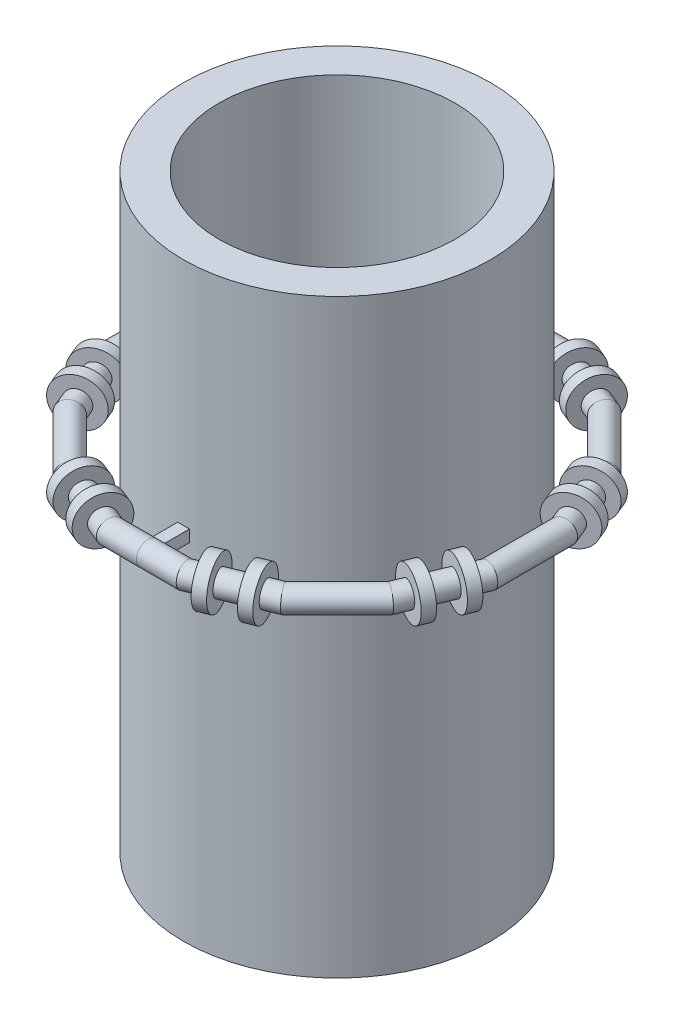
from build123d import *

# Parameters (mm, degrees)
CROQUIS1_R                   = 6.5
CROQUIS1_R_2                 = 5
SALIENTE_EXTRUIR1_DEPTH      = 25
CROQUIS3_R                   = 0.5
SALIENTE_EXTRUIR2_REACH      = 32.125
SALIENTE_EXTRUIR2_END_RADIUS = 0.5
CROQUIS4_W                   = 0.5
CROQUIS4_H                   = 0.5
SALIENTE_EXTRUIR3_REACH      = 32.125
SALIENTE_EXTRUIR3_END_RADIUS = 0.5
CROQUIS6_W                   = 0.5
CROQUIS6_H                   = 0.5
CROQUIS9_R                   = 1
SALIENTE_EXTRUIR4_DEPTH      = 0.5
SIMETR_A2_COPY_1_SKETCH_R    = 1
SIMETR_A2_COPY_1_DEPTH       = 0.5
SIMETR_A3_COPY_1_SKETCH_R    = 1
SIMETR_A3_COPY_1_DEPTH       = 0.5
SIMETR_A3_COPY_2_SKETCH_R    = 1
SIMETR_A3_COPY_2_DEPTH       = 0.5
SIMETR_A3_COPY_3_SKETCH_R    = 1
SIMETR_A3_COPY_3_DEPTH       = 0.5
SIMETR_A4_COPY_1_SKETCH_R    = 1
SIMETR_A4_COPY_1_DEPTH       = 0.5
SIMETR_A4_COPY_2_SKETCH_R    = 1
SIMETR_A4_COPY_2_DEPTH       = 0.5
SIMETR_A4_COPY_3_SKETCH_R    = 1
SIMETR_A4_COPY_3_DEPTH       = 0.5
SIMETR_A4_COPY_4_SKETCH_R    = 1
SIMETR_A4_COPY_4_DEPTH       = 0.5
SIMETR_A4_COPY_5_SKETCH_R    = 1
SIMETR_A4_COPY_5_DEPTH       = 0.5
SIMETR_A4_COPY_6_SKETCH_R    = 1
SIMETR_A4_COPY_6_DEPTH       = 0.5
SIMETR_A4_COPY_7_SKETCH_R    = 1
SIMETR_A4_COPY_7_DEPTH       = 0.5
SIMETR_A4_COPY_8_SKETCH_R    = 1
SIMETR_A4_COPY_8_DEPTH       = 0.5
SIMETR_A5_COPY_1_SKETCH_R    = 1
SIMETR_A5_COPY_1_DEPTH       = 0.5
SIMETR_A5_COPY_2_SKETCH_R    = 1
SIMETR_A5_COPY_2_DEPTH       = 0.5
SIMETR_A5_COPY_3_SKETCH_R    = 1
SIMETR_A5_COPY_3_DEPTH       = 0.5
SIMETR_A5_COPY_4_SKETCH_R    = 1
SIMETR_A5_COPY_4_DEPTH       = 0.5
SIMETR_A5_COPY_5_SKETCH_R    = 1
SIMETR_A5_COPY_5_DEPTH       = 0.5
SIMETR_A5_COPY_6_SKETCH_R    = 1
SIMETR_A5_COPY_6_DEPTH       = 0.5
SIMETR_A5_COPY_7_SKETCH_R    = 1
SIMETR_A5_COPY_7_DEPTH       = 0.5
SIMETR_A5_COPY_8_SKETCH_R    = 1
SIMETR_A5_COPY_8_DEPTH       = 0.5
SIMETR_A5_COPY_9_SKETCH_R    = 1
SIMETR_A5_COPY_9_DEPTH       = 0.5


with BuildPart() as part:
    # Croquis1 → Saliente-Extruir1 (new body)
    with BuildSketch(Plane(origin=(0, 0, 0), x_dir=(1, 0, 0), z_dir=(0, 1, 0))):
        with Locations(Location((0, 0, 0), (0, 0, 270))):
            Circle(CROQUIS1_R)
        with Locations(Location((0, 0, 0), (0, 0, 270))):
            Circle(CROQUIS1_R_2, mode=Mode.SUBTRACT)
    extrude(amount=SALIENTE_EXTRUIR1_DEPTH)



with BuildPart() as body_2:
    # Barrer1: sweep along a path in Croquis2
    with BuildLine(Plane(origin=(0, 15, 0), x_dir=(1, 0, 0), z_dir=(0, 1, 0))) as barrer1_path:
        Line((-4.531635979, -6.78207252), (-1.591298939, -8))
        Line((-1.591298939, -8), (1.591298939, -8))
        Line((1.591298939, -8), (4.531635979, -6.78207252))
        Line((4.531635979, -6.78207252), (6.78207252, -4.531635979))
        Line((6.78207252, -4.531635979), (8, -1.591298939))
        Line((8, -1.591298939), (8, 1.591298939))
        Line((8, 1.591298939), (6.78207252, 4.531635979))
        Line((6.78207252, 4.531635979), (4.531635979, 6.78207252))
        Line((4.531635979, 6.78207252), (1.591298939, 8))
        Line((1.591298939, 8), (-1.591298939, 8))
        Line((-1.591298939, 8), (-4.531635979, 6.78207252))
        Line((-4.531635979, 6.78207252), (-6.78207252, 4.531635979))
        Line((-6.78207252, 4.531635979), (-8, 1.591298939))
        Line((-8, 1.591298939), (-8, -1.591298939))
        Line((-8, -1.591298939), (-6.78207252, -4.531635979))
        Line((-6.78207252, -4.531635979), (-4.531635979, -6.78207252))
    # Croquis3 → Barrer1 (sweep)
    with BuildSketch(Plane(origin=(0, 0, 0), x_dir=(0, 0, -1), z_dir=(1, 0, 0))):
        with Locations((-8, 15)):
            Circle(CROQUIS3_R)
    sweep(path=barrer1_path.line, transition=Transition.RIGHT)


with BuildPart() as part_1:
    add(part.part)

    add(body_2.part)  # Saliente-Extruir2 merges body 2
    # Saliente-Extruir2: up to this cylinder (the profile starts outside it)
    saliente_extruir2_end = Plane(origin=(0, 15, 8), z_dir=(-1, 0, 0)) * Cylinder(SALIENTE_EXTRUIR2_END_RADIUS, 66.25, mode=Mode.PRIVATE)
    # Croquis4 → Saliente-Extruir2 (add, up to the surface)
    with BuildSketch(Plane.XY.offset(6), mode=Mode.PRIVATE) as saliente_extruir2_sk1:
        with Locations((0, 15)):
            Rectangle(CROQUIS4_W, CROQUIS4_H)
    saliente_extruir2_tool1 = extrude(saliente_extruir2_sk1.sketch, amount=SALIENTE_EXTRUIR2_REACH, mode=Mode.PRIVATE) - saliente_extruir2_end
    add(saliente_extruir2_tool1.solids().sort_by_distance((0, 15, 6))[0])

    # Saliente-Extruir3: up to this cylinder (the profile starts outside it)
    saliente_extruir3_end = Plane(origin=(0, 15, -8), z_dir=(1, 0, 0)) * Cylinder(SALIENTE_EXTRUIR3_END_RADIUS, 66.25, mode=Mode.PRIVATE)
    # Croquis6 → Saliente-Extruir3 (add, up to the surface)
    with BuildSketch(Plane.XY.offset(-6), mode=Mode.PRIVATE) as saliente_extruir3_sk1:
        with Locations((0, 15)):
            Rectangle(CROQUIS6_W, CROQUIS6_H)
    saliente_extruir3_tool1 = extrude(saliente_extruir3_sk1.sketch, amount=-SALIENTE_EXTRUIR3_REACH, mode=Mode.PRIVATE) - saliente_extruir3_end
    add(saliente_extruir3_tool1.solids().sort_by_distance((0, 15, -6))[0])

    # Croquis9 → Saliente-Extruir4 (add)
    with BuildSketch(Plane(origin=(-0.461939766, 0, -0.191341716), x_dir=(-0.3826834323650839, 0, 0.9238795325112892), z_dir=(-0.9238795325112892, 0, -0.3826834323650839))):
        with Locations((8, 15)):
            Circle(CROQUIS9_R)
    saliente_extruir4 = extrude(amount=SALIENTE_EXTRUIR4_DEPTH)

    # Simetría1: Saliente-Extruir4 across plane
    add(saliente_extruir4.mirror(Plane(origin=(0, 0, 0), x_dir=(-0.3826834323650839, 0, 0.9238795325112891), z_dir=(-0.9238795325112892, 0, -0.3826834323650839))))

    # Simetría2: Saliente-Extruir4 across plane
    add(saliente_extruir4.mirror(Plane.XY))

    # Simetría2 copy 1 sketch → Simetría2 copy 1 (add)
    with BuildSketch(Plane(origin=(0.461939766, 0, -0.191341716), x_dir=(-0.38268343236508395, 0, -0.9238795325112892), z_dir=(0.9238795325112892, 0, -0.38268343236508395))):
        with Locations((8, 15)):
            Circle(SIMETR_A2_COPY_1_SKETCH_R)
    extrude(amount=SIMETR_A2_COPY_1_DEPTH)

    # Simetría3: Saliente-Extruir4 across plane
    add(saliente_extruir4.mirror(Plane(origin=(0, 0, 0), x_dir=(0, 0, 1), z_dir=(1, 0, 0))))

    # Simetría3 copy 1 sketch → Simetría3 copy 1 (add)
    with BuildSketch(Plane(origin=(-0.461939766, 0, 0.191341716), x_dir=(0.38268343236508395, 0, 0.9238795325112892), z_dir=(-0.9238795325112892, 0, 0.38268343236508395))):
        with Locations((8, 15)):
            Circle(SIMETR_A3_COPY_1_SKETCH_R)
    extrude(amount=SIMETR_A3_COPY_1_DEPTH)

    # Simetría3 copy 2 sketch → Simetría3 copy 2 (add)
    with BuildSketch(Plane(origin=(0.461939766, 0, 0.191341716), x_dir=(0.3826834323650839, 0, -0.9238795325112892), z_dir=(0.9238795325112892, 0, 0.3826834323650839))):
        with Locations((8, 15)):
            Circle(SIMETR_A3_COPY_2_SKETCH_R)
    extrude(amount=SIMETR_A3_COPY_2_DEPTH)

    # Simetría3 copy 3 sketch → Simetría3 copy 3 (add)
    with BuildSketch(Plane(origin=(-0.461939766, 0, -0.191341716), x_dir=(0.38268343236508395, 0, -0.9238795325112892), z_dir=(-0.9238795325112892, 0, -0.38268343236508395))):
        with Locations((8, -15)):
            Circle(SIMETR_A3_COPY_3_SKETCH_R)
    extrude(amount=SIMETR_A3_COPY_3_DEPTH)

    # Simetría4 copy 1 sketch → Simetría4 copy 1 (add)
    with BuildSketch(Plane(origin=(0.191341716, 0, 0.461939766), x_dir=(0.9238795325112795, 0, -0.3826834323651074), z_dir=(0.3826834323651074, 0, 0.9238795325112795))):
        with Locations((8, 15)):
            Circle(SIMETR_A4_COPY_1_SKETCH_R)
    extrude(amount=SIMETR_A4_COPY_1_DEPTH)

    # Simetría4 copy 2 sketch → Simetría4 copy 2 (add)
    with BuildSketch(Plane(origin=(-0.191341716, 0, -0.461939766), x_dir=(0.9238795325112796, 0, -0.3826834323651075), z_dir=(-0.3826834323651075, 0, -0.9238795325112796))):
        with Locations((8, -15)):
            Circle(SIMETR_A4_COPY_2_SKETCH_R)
    extrude(amount=SIMETR_A4_COPY_2_DEPTH)

    # Simetría4 copy 3 sketch → Simetría4 copy 3 (add)
    with BuildSketch(Plane(origin=(0.461939766, 0, 0.191341716), x_dir=(-0.38268343236508395, 0, 0.9238795325112892), z_dir=(0.9238795325112892, 0, 0.38268343236508395))):
        with Locations((8, -15)):
            Circle(SIMETR_A4_COPY_3_SKETCH_R)
    extrude(amount=SIMETR_A4_COPY_3_DEPTH)

    # Simetría4 copy 4 sketch → Simetría4 copy 4 (add)
    with BuildSketch(Plane(origin=(-0.191341716, 0, -0.461939766), x_dir=(-0.9238795325112795, 0, 0.3826834323651074), z_dir=(-0.3826834323651074, 0, -0.9238795325112795))):
        with Locations((8, 15)):
            Circle(SIMETR_A4_COPY_4_SKETCH_R)
    extrude(amount=SIMETR_A4_COPY_4_DEPTH)

    # Simetría4 copy 5 sketch → Simetría4 copy 5 (add)
    with BuildSketch(Plane(origin=(0.191341716, 0, 0.461939766), x_dir=(-0.9238795325112796, 0, 0.3826834323651075), z_dir=(0.3826834323651075, 0, 0.9238795325112796))):
        with Locations((8, -15)):
            Circle(SIMETR_A4_COPY_5_SKETCH_R)
    extrude(amount=SIMETR_A4_COPY_5_DEPTH)

    # Simetría4 copy 6 sketch → Simetría4 copy 6 (add)
    with BuildSketch(Plane(origin=(-0.461939766, 0, -0.191341716), x_dir=(0.38268343236508395, 0, -0.9238795325112892), z_dir=(-0.9238795325112892, 0, -0.38268343236508395))):
        with Locations((8, -15)):
            Circle(SIMETR_A4_COPY_6_SKETCH_R)
    extrude(amount=SIMETR_A4_COPY_6_DEPTH)

    # Simetría4 copy 7 sketch → Simetría4 copy 7 (add)
    with BuildSketch(Plane(origin=(0.461939766, 0, 0.191341716), x_dir=(0.3826834323650839, 0, -0.9238795325112892), z_dir=(0.9238795325112892, 0, 0.3826834323650839))):
        with Locations((8, 15)):
            Circle(SIMETR_A4_COPY_7_SKETCH_R)
    extrude(amount=SIMETR_A4_COPY_7_DEPTH)

    # Simetría4 copy 8 sketch → Simetría4 copy 8 (add)
    with BuildSketch(Plane(origin=(0.461939766, 0, 0.191341716), x_dir=(-0.38268343236508395, 0, 0.9238795325112892), z_dir=(0.9238795325112892, 0, 0.38268343236508395))):
        with Locations((8, -15)):
            Circle(SIMETR_A4_COPY_8_SKETCH_R)
    extrude(amount=SIMETR_A4_COPY_8_DEPTH)

    # Simetría5 copy 1 sketch → Simetría5 copy 1 (add)
    with BuildSketch(Plane(origin=(-0.191341716, 0, 0.461939766), x_dir=(-0.9238795325112795, 0, -0.3826834323651074), z_dir=(-0.3826834323651074, 0, 0.9238795325112795))):
        with Locations((8, -15)):
            Circle(SIMETR_A5_COPY_1_SKETCH_R)
    extrude(amount=SIMETR_A5_COPY_1_DEPTH)

    # Simetría5 copy 2 sketch → Simetría5 copy 2 (add)
    with BuildSketch(Plane(origin=(0.191341716, 0, -0.461939766), x_dir=(-0.9238795325112796, 0, -0.3826834323651075), z_dir=(0.3826834323651075, 0, -0.9238795325112796))):
        with Locations((8, 15)):
            Circle(SIMETR_A5_COPY_2_SKETCH_R)
    extrude(amount=SIMETR_A5_COPY_2_DEPTH)

    # Simetría5 copy 3 sketch → Simetría5 copy 3 (add)
    with BuildSketch(Plane(origin=(-0.461939766, 0, 0.191341716), x_dir=(0.38268343236508395, 0, 0.9238795325112892), z_dir=(-0.9238795325112892, 0, 0.38268343236508395))):
        with Locations((8, 15)):
            Circle(SIMETR_A5_COPY_3_SKETCH_R)
    extrude(amount=SIMETR_A5_COPY_3_DEPTH)

    # Simetría5 copy 4 sketch → Simetría5 copy 4 (add)
    with BuildSketch(Plane(origin=(0.191341716, 0, -0.461939766), x_dir=(0.9238795325112795, 0, 0.3826834323651074), z_dir=(0.3826834323651074, 0, -0.9238795325112795))):
        with Locations((8, -15)):
            Circle(SIMETR_A5_COPY_4_SKETCH_R)
    extrude(amount=SIMETR_A5_COPY_4_DEPTH)

    # Simetría5 copy 5 sketch → Simetría5 copy 5 (add)
    with BuildSketch(Plane(origin=(-0.191341716, 0, 0.461939766), x_dir=(0.9238795325112796, 0, 0.3826834323651075), z_dir=(-0.3826834323651075, 0, 0.9238795325112796))):
        with Locations((8, 15)):
            Circle(SIMETR_A5_COPY_5_SKETCH_R)
    extrude(amount=SIMETR_A5_COPY_5_DEPTH)

    # Simetría5 copy 6 sketch → Simetría5 copy 6 (add)
    with BuildSketch(Plane(origin=(0.461939766, 0, -0.191341716), x_dir=(-0.38268343236508395, 0, -0.9238795325112892), z_dir=(0.9238795325112892, 0, -0.38268343236508395))):
        with Locations((8, 15)):
            Circle(SIMETR_A5_COPY_6_SKETCH_R)
    extrude(amount=SIMETR_A5_COPY_6_DEPTH)

    # Simetría5 copy 7 sketch → Simetría5 copy 7 (add)
    with BuildSketch(Plane(origin=(-0.461939766, 0, 0.191341716), x_dir=(-0.3826834323650839, 0, -0.9238795325112892), z_dir=(-0.9238795325112892, 0, 0.3826834323650839))):
        with Locations((8, -15)):
            Circle(SIMETR_A5_COPY_7_SKETCH_R)
    extrude(amount=SIMETR_A5_COPY_7_DEPTH)

    # Simetría5 copy 8 sketch → Simetría5 copy 8 (add)
    with BuildSketch(Plane(origin=(-0.461939766, 0, 0.191341716), x_dir=(0.38268343236508395, 0, 0.9238795325112892), z_dir=(-0.9238795325112892, 0, 0.38268343236508395))):
        with Locations((8, 15)):
            Circle(SIMETR_A5_COPY_8_SKETCH_R)
    extrude(amount=SIMETR_A5_COPY_8_DEPTH)

    # Simetría5 copy 9 sketch → Simetría5 copy 9 (add)
    with BuildSketch(Plane(origin=(0.461939766, 0, -0.191341716), x_dir=(0.3826834323650839, 0, 0.9238795325112892), z_dir=(0.9238795325112892, 0, -0.3826834323650839))):
        with Locations((8, -15)):
            Circle(SIMETR_A5_COPY_9_SKETCH_R)
    extrude(amount=SIMETR_A5_COPY_9_DEPTH)


solid = part_1.part
